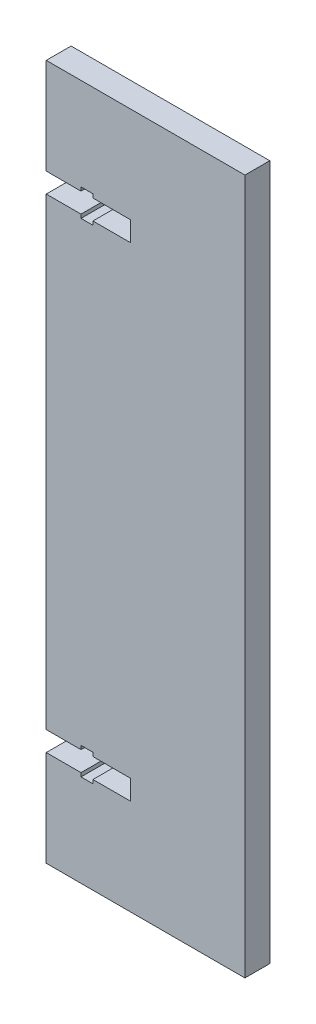
from build123d import *

# Parameters (mm, degrees)
SKETCH1_W           = 40
SKETCH1_H           = 140
BOSS_EXTRUDE1_DEPTH = 5
CUT_EXTRUDE1_DEPTH  = 10


with BuildPart() as part:
    # Sketch1 → Boss-Extrude1 (new body)
    with BuildSketch(Plane.XY):
        with Locations((-15.285545967, 18.561603806)):
            Rectangle(SKETCH1_W, SKETCH1_H)
    extrude(amount=BOSS_EXTRUDE1_DEPTH)

    # Sketch4 → Cut-Extrude1 (cut)
    with BuildSketch(Plane(origin=(0, 0, 0), x_dir=(-1, 0, 0), z_dir=(0, 0, -1))):
        Polygon((35.285545967, 65.251700466), (28.285545967, 65.251700466), (28.285545967, 64.501700466), (25.885545967, 64.501700466), (25.885545967, 65.251700466), (18.285545967, 65.251700466), (18.285545967, 69.251700466), (25.885545967, 69.251700466), (25.885545967, 70.001700466), (28.285545967, 70.001700466), (28.285545967, 69.251700466), (35.285545967, 69.251700466), align=None)
        Polygon((35.285545967, -28.128492854), (35.285545967, -32.128492854), (28.285545967, -32.128492854), (28.285545967, -32.878492854), (25.885545967, -32.878492854), (25.885545967, -32.128492854), (18.285545967, -32.128492854), (18.285545967, -28.128492854), (25.885545967, -28.128492854), (25.885545967, -27.378492854), (28.285545967, -27.378492854), (28.285545967, -28.128492854), align=None)
    extrude(amount=-CUT_EXTRUDE1_DEPTH, mode=Mode.SUBTRACT)


solid = part.part
